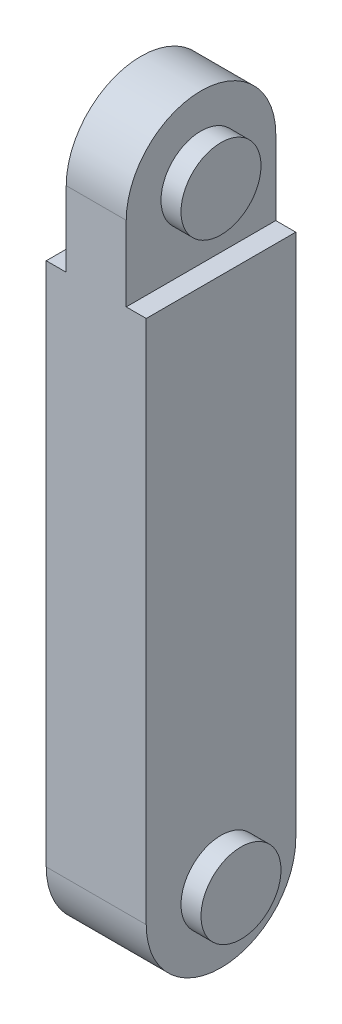
from build123d import *

# Parameters (mm, degrees)
BOSS_EXTRUDE1_DEPTH = 100
CUT_EXTRUDE2_DEPTH  = 20
CUT_EXTRUDE3_START  = -20
CUT_EXTRUDE3_DEPTH  = 20
SKETCH9_R           = 40
BOSS_EXTRUDE2_DEPTH = 20
BOSS_EXTRUDE3_START = 20
SKETCH2_R           = 40
BOSS_EXTRUDE3_DEPTH = 20
SKETCH10_R          = 40
BOSS_EXTRUDE6_DEPTH = 20
BOSS_EXTRUDE7_START = 20
SKETCH11_R          = 40
BOSS_EXTRUDE7_DEPTH = 20


with BuildPart() as part:
    # Sketch1 → Boss-Extrude1 (new body)
    with BuildSketch(Plane(origin=(0, 0, 0), x_dir=(0, 0, -1), z_dir=(1, 0, 0))):
        with BuildLine():
            Line((-74.767803634, 0), (-74.767803634, 600))
            ThreePointArc((-74.767803634, 600), (0, 674.767803634), (74.767803634, 600))
            Line((74.767803634, 600), (74.767803634, 0))
            ThreePointArc((74.767803634, 0), (0, -74.767803634), (-74.767803634, 0))
        make_face()
    extrude(amount=BOSS_EXTRUDE1_DEPTH)

    # Sketch8 → Cut-Extrude2 (cut)
    with BuildSketch(Plane.ZY):
        with BuildLine():
            Line((-74.767803634, 600), (-74.767803634, 525))
            Line((-74.767803634, 525), (74.767803634, 525))
            Line((74.767803634, 525), (74.767803634, 600))
            ThreePointArc((74.767803634, 600), (0, 674.767803634), (-74.767803634, 600))
        make_face()
    extrude(amount=-CUT_EXTRUDE2_DEPTH, mode=Mode.SUBTRACT)

    # Sketch7 → Cut-Extrude3 (cut)
    with BuildSketch(Plane(origin=(100, 0, 0), x_dir=(0, 0, -1), z_dir=(1, 0, 0)).offset(CUT_EXTRUDE3_START)):
        with BuildLine():
            Line((-74.767803634, 600), (-74.767803634, 525))
            Line((-74.767803634, 525), (74.767803634, 525))
            Line((74.767803634, 525), (74.767803634, 600))
            ThreePointArc((74.767803634, 600), (0, 674.767803634), (-74.767803634, 600))
        make_face()
    extrude(amount=CUT_EXTRUDE3_DEPTH, mode=Mode.SUBTRACT)

    # Sketch9 → Boss-Extrude2 (add)
    with BuildSketch(Plane.ZY):
        with Locations(Location((0, 0, 0), (0, 0, 180))):
            Circle(SKETCH9_R)
    extrude(amount=BOSS_EXTRUDE2_DEPTH)

    # Sketch2 → Boss-Extrude3 (add)
    with BuildSketch(Plane(origin=(100, 0, 0), x_dir=(0, 0, -1), z_dir=(1, 0, 0)).offset(BOSS_EXTRUDE3_START)):
        Circle(SKETCH2_R)
    extrude(amount=-BOSS_EXTRUDE3_DEPTH)

    # Sketch10 → Boss-Extrude6 (add)
    with BuildSketch(Plane(origin=(80, 0, 0), x_dir=(0, 0, -1), z_dir=(1, 0, 0))):
        with Locations(Location((0, 600, 0), (0, 0, 180))):
            Circle(SKETCH10_R)
    extrude(amount=BOSS_EXTRUDE6_DEPTH)

    # Sketch11 → Boss-Extrude7 (add)
    with BuildSketch(Plane.ZY.offset(-20).offset(BOSS_EXTRUDE7_START)):
        with Locations((0, 600)):
            Circle(SKETCH11_R)
    extrude(amount=-BOSS_EXTRUDE7_DEPTH)


solid = part.part
